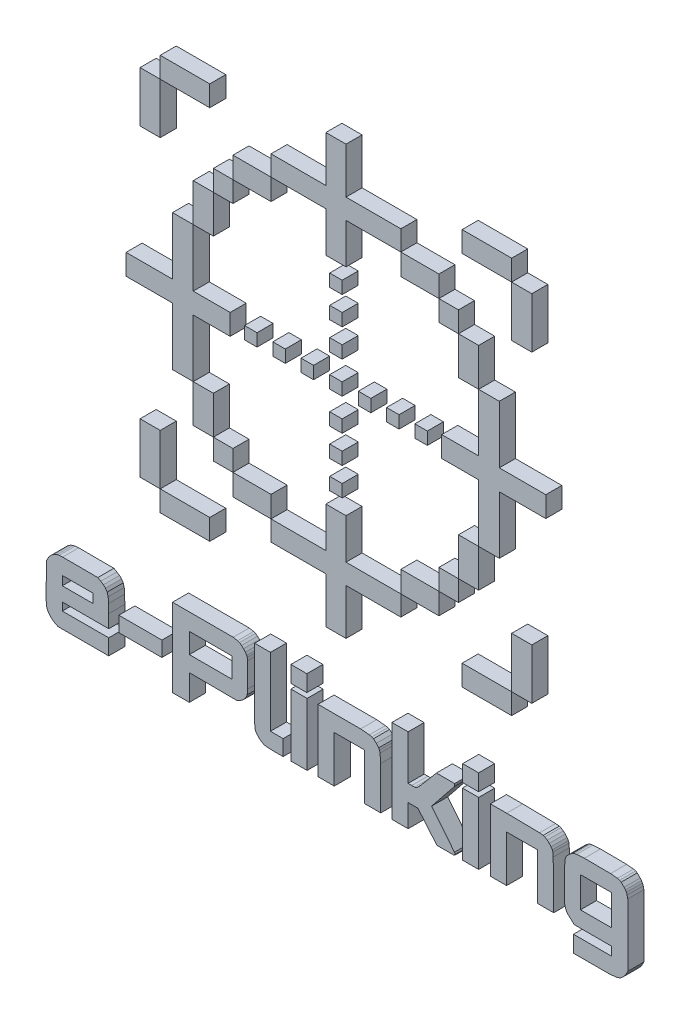
from build123d import *

# Parameters (mm, degrees)
FRAME_190_X_150_W           = 12.335633057
FRAME_190_X_150_H           = 5.156887646
RESSALTO_EXTRUS_O4_DEPTH    = 4
FRAME_190_X_150_W_2         = 5.017869899
FRAME_190_X_150_H_2         = 12.614788256
RESSALTO_EXTRUS_O4_2_DEPTH  = 4
FRAME_190_X_150_W_3         = 5.0178699
RESSALTO_EXTRUS_O4_3_DEPTH  = 4
FRAME_190_X_150_W_4         = 12.335633056
RESSALTO_EXTRUS_O4_4_DEPTH  = 4
FRAME_190_X_150_W_5         = 7.666212514
FRAME_190_X_150_H_3         = 2.230469951
RESSALTO_EXTRUS_O4_5_DEPTH  = 4
FRAME_190_X_150_W_6         = 10.732701735
FRAME_190_X_150_H_4         = 3.762804679
RESSALTO_EXTRUS_O4_6_DEPTH  = 4
FRAME_190_X_150_W_7         = 10.593312509
FRAME_190_X_150_H_5         = 5.0178699
RESSALTO_EXTRUS_O4_7_DEPTH  = 4
RESSALTO_EXTRUS_O4_8_DEPTH  = 4
FRAME_190_X_150_W_8         = 3.979554766
FRAME_190_X_150_H_6         = 4.087064128
RESSALTO_EXTRUS_O4_9_DEPTH  = 4
FRAME_190_X_150_W_9         = 4.042187463
FRAME_190_X_150_H_7         = 15.541508117
RESSALTO_EXTRUS_O4_10_DEPTH = 4
RESSALTO_EXTRUS_O4_11_DEPTH = 4
RESSALTO_EXTRUS_O4_12_DEPTH = 4
FRAME_190_X_150_W_10        = 3.972590477
RESSALTO_EXTRUS_O4_13_DEPTH = 4
FRAME_190_X_150_W_11        = 4.049210035
RESSALTO_EXTRUS_O4_14_DEPTH = 4
RESSALTO_EXTRUS_O4_15_DEPTH = 4
FRAME_190_X_150_W_12        = 7.735909971
FRAME_190_X_150_H_8         = 7.596504733
RESSALTO_EXTRUS_O4_16_DEPTH = 4
RESSALTO_EXTRUS_O4_17_DEPTH = 4
RESSALTO_EXTRUS_O4_18_DEPTH = 4
RESSALTO_EXTRUS_O4_19_DEPTH = 4
RESSALTO_EXTRUS_O4_20_DEPTH = 4
RESSALTO_EXTRUS_O4_21_DEPTH = 4
RESSALTO_EXTRUS_O4_22_DEPTH = 4
FRAME_190_X_150_W_13        = 9.478251135
FRAME_190_X_150_H_9         = 5.296605935
RESSALTO_EXTRUS_O4_23_DEPTH = 4
FRAME_190_X_150_W_14        = 4.878496646
FRAME_190_X_150_H_10        = 5.157269663
RESSALTO_EXTRUS_O4_24_DEPTH = 4
FRAME_190_X_150_H_11        = 9.471940172
RESSALTO_EXTRUS_O4_25_DEPTH = 4
RESSALTO_EXTRUS_O4_26_DEPTH = 4
FRAME_190_X_150_W_15        = 9.478251136
RESSALTO_EXTRUS_O4_27_DEPTH = 4
FRAME_190_X_150_W_16        = 4.878496645
RESSALTO_EXTRUS_O4_28_DEPTH = 4
RESSALTO_EXTRUS_O4_29_DEPTH = 4
RESSALTO_EXTRUS_O4_30_DEPTH = 4
RESSALTO_EXTRUS_O4_31_DEPTH = 4
RESSALTO_EXTRUS_O4_32_DEPTH = 4
FRAME_190_X_150_H_12        = 9.471940171
RESSALTO_EXTRUS_O4_33_DEPTH = 4
RESSALTO_EXTRUS_O4_34_DEPTH = 4
RESSALTO_EXTRUS_O4_35_DEPTH = 4
RESSALTO_EXTRUS_O4_36_DEPTH = 4
FRAME_190_X_150_W_17        = 3.111095359
FRAME_190_X_150_H_13        = 3.111095359
RESSALTO_EXTRUS_O4_37_DEPTH = 4
RESSALTO_EXTRUS_O4_38_DEPTH = 4
RESSALTO_EXTRUS_O4_39_DEPTH = 4
RESSALTO_EXTRUS_O4_40_DEPTH = 4
FRAME_190_X_150_W_18        = 3.111095358
RESSALTO_EXTRUS_O4_41_DEPTH = 4
RESSALTO_EXTRUS_O4_42_DEPTH = 4
RESSALTO_EXTRUS_O4_43_DEPTH = 4
RESSALTO_EXTRUS_O4_44_DEPTH = 4
RESSALTO_EXTRUS_O4_45_DEPTH = 4
RESSALTO_EXTRUS_O4_46_DEPTH = 4
FRAME_190_X_150_H_14        = 3.111095358
RESSALTO_EXTRUS_O4_47_DEPTH = 4
RESSALTO_EXTRUS_O4_48_DEPTH = 4
RESSALTO_EXTRUS_O4_49_DEPTH = 4


with BuildPart() as part:
    # Frame 190 x 150 → Ressalto-extrusão4 (new body)
    with BuildSketch(Plane.XY):
        with Locations((-37.518982292, -26.483801688)):
            Rectangle(FRAME_190_X_150_W, FRAME_190_X_150_H)
    extrude(amount=RESSALTO_EXTRUS_O4_DEPTH)


with BuildPart() as body_2:
    # Frame 190 x 150 → Ressalto-extrus_o4 2 (new body)
    with BuildSketch(Plane.XY):
        with Locations((-46.19573377, -17.597963737)):
            Rectangle(FRAME_190_X_150_W_2, FRAME_190_X_150_H_2)
    extrude(amount=RESSALTO_EXTRUS_O4_2_DEPTH)


with BuildPart() as body_3:
    # Frame 190 x 150 → Ressalto-extrus_o4 3 (new body)
    with BuildSketch(Plane.XY):
        with Locations((46.355888486, -17.597963737)):
            Rectangle(FRAME_190_X_150_W_3, FRAME_190_X_150_H_2)
    extrude(amount=RESSALTO_EXTRUS_O4_3_DEPTH)


with BuildPart() as body_4:
    # Frame 190 x 150 → Ressalto-extrus_o4 4 (new body)
    with BuildSketch(Plane.XY):
        with Locations((37.679137008, -26.483801688)):
            Rectangle(FRAME_190_X_150_W_4, FRAME_190_X_150_H)
    extrude(amount=RESSALTO_EXTRUS_O4_4_DEPTH)


with BuildPart() as body_5:
    # Frame 190 x 150 → Ressalto-extrus_o4 5 (new body)
    with BuildSketch(Plane.XY):
        Polygon((-68.869344875, -50.835307482), (-67.983813166, -50.770338374), (-59.228510836, -50.806122616), (-58.482023291, -51.21959113), (-57.835129582, -51.656288372), (-57.328088695, -52.125597393), (-56.899627634, -52.782485781), (-56.651991155, -53.657518124), (-56.538004284, -55.045981586), (-56.510492046, -57.243468657), (-56.510492046, -60.493736295), (-68.079508065, -60.493736295), (-68.079508065, -62.462169884), (-56.510492046, -62.445101171), (-56.510492046, -66.347630733), (-69.124898287, -66.344436369), (-69.827144147, -66.017891859), (-70.508264841, -65.593038935), (-71.120546464, -65.009283662), (-71.610311074, -64.328233035), (-71.923882835, -63.611492992), (-72.031223444, -63.054457104), (-72.090266969, -62.139327509), (-72.051998281, -53.593828116), (-71.674263435, -52.877684951), (-71.249875159, -52.231957078), (-70.717564146, -51.683814833), (-70.099616131, -51.252240313), (-69.388617133, -50.949675405), align=None)
        with Locations((-64.246401808, -55.89384969)):
            Rectangle(FRAME_190_X_150_W_5, FRAME_190_X_150_H_3, mode=Mode.SUBTRACT)
    extrude(amount=RESSALTO_EXTRUS_O4_5_DEPTH)


with BuildPart() as body_6:
    # Frame 190 x 150 → Ressalto-extrus_o4 6 (new body)
    with BuildSketch(Plane.XY):
        with Locations((-48.635203594, -58.194171546)):
            Rectangle(FRAME_190_X_150_W_6, FRAME_190_X_150_H_4)
    extrude(amount=RESSALTO_EXTRUS_O4_6_DEPTH)


with BuildPart() as body_7:
    # Frame 190 x 150 → Ressalto-extrus_o4 7 (new body)
    with BuildSketch(Plane.XY):
        Polygon((-36.438954496, -66.340281739), (-40.620525917, -66.340281739), (-40.620525917, -46.82527381), (-25.507074981, -46.82527381), (-24.422824579, -47.031835273), (-23.963932214, -47.205453064), (-23.44963607, -47.551278899), (-22.935708694, -48.014130256), (-22.478018515, -48.537310034), (-22.132432907, -49.064120074), (-21.993611584, -49.436708492), (-21.90933165, -50.074356648), (-21.951471617, -56.237777076), (-22.018569962, -57.496724298), (-22.288512194, -58.153539986), (-22.660069641, -58.708447025), (-23.149983339, -59.181418971), (-23.774993271, -59.592430433), (-24.521478583, -60.005902979), (-36.438954496, -59.924421917), align=None)
        with Locations((-31.142298242, -53.524451509)):
            Rectangle(FRAME_190_X_150_W_7, FRAME_190_X_150_H_5, mode=Mode.SUBTRACT)
    extrude(amount=RESSALTO_EXTRUS_O4_7_DEPTH)


with BuildPart() as body_8:
    # Frame 190 x 150 → Ressalto-extrus_o4 8 (new body)
    with BuildSketch(Plane.XY):
        Polygon((-20.159080754, -62.68228913), (-20.159080754, -45.440079454), (-16.228048548, -45.440079454), (-16.228048548, -62.467317111), (-13.061605111, -62.464445985), (-13.061605111, -66.347578419), (-15.758864703, -66.35002412), (-17.100603293, -66.294097935), (-17.598367545, -66.215262605), (-17.971780951, -66.084293417), (-18.544928861, -65.760611078), (-19.081120372, -65.338386419), (-19.54154418, -64.853088649), (-19.887412159, -64.340039469), (-20.064088622, -63.862728698), align=None)
    extrude(amount=RESSALTO_EXTRUS_O4_8_DEPTH)


with BuildPart() as body_9:
    # Frame 190 x 150 → Ressalto-extrus_o4 9 (new body)
    with BuildSketch(Plane.XY):
        with Locations((-9.15074114, -47.553297957)):
            Rectangle(FRAME_190_X_150_W_8, FRAME_190_X_150_H_6)
    extrude(amount=RESSALTO_EXTRUS_O4_9_DEPTH)


with BuildPart() as body_10:
    # Frame 190 x 150 → Ressalto-extrus_o4 10 (new body)
    with BuildSketch(Plane.XY):
        with Locations((-9.119424792, -58.576876674)):
            Rectangle(FRAME_190_X_150_W_9, FRAME_190_X_150_H_7)
    extrude(amount=RESSALTO_EXTRUS_O4_10_DEPTH)


with BuildPart() as body_11:
    # Frame 190 x 150 → Ressalto-extrus_o4 11 (new body)
    with BuildSketch(Plane.XY):
        Polygon((8.402580971, -50.924974899), (6.224273851, -50.725864668), (-0.338051222, -50.725864668), (-4.380238684, -50.725864668), (-4.380238684, -66.347630733), (-0.338051222, -66.347630733), (-0.338051222, -54.778614714), (7.188936992, -54.778614714), (7.188936992, -66.347630733), (11.241379874, -66.347630733), (11.241379874, -55.669331308), (11.054377893, -53.525832247), (10.933207411, -52.943834947), (10.749718213, -52.545836272), (10.138693563, -51.874325685), (9.430858753, -51.243906447), (9.008624085, -51.052623063), align=None)
    extrude(amount=RESSALTO_EXTRUS_O4_11_DEPTH)


with BuildPart() as body_12:
    # Frame 190 x 150 → Ressalto-extrus_o4 12 (new body)
    with BuildSketch(Plane.XY):
        Polygon((18.060884257, -60.702507483), (18.060884257, -66.347630733), (14.018696795, -66.347630733), (14.018696795, -45.440079454), (18.060884257, -45.440079454), (18.060884257, -56.562016339), (18.973591861, -56.562016339), (19.665189081, -56.555233118), (20.144030768, -56.481676969), (21.055733445, -55.580381982), (25.104489113, -50.806122616), (29.652433594, -50.806122616), (29.62989502, -51.160435483), (29.541480137, -51.530099567), (23.915084257, -58.538782036), (29.605751219, -65.644555984), (29.767150657, -66.0340124), (29.73184476, -66.214831714), (29.46390878, -66.344436369), (25.239247662, -66.345526959), (20.496454906, -60.702507483), align=None)
    extrude(amount=RESSALTO_EXTRUS_O4_12_DEPTH)


with BuildPart() as body_13:
    # Frame 190 x 150 → Ressalto-extrus_o4 13 (new body)
    with BuildSketch(Plane.XY):
        with Locations((33.637152285, -47.553297957)):
            Rectangle(FRAME_190_X_150_W_10, FRAME_190_X_150_H_6)
    extrude(amount=RESSALTO_EXTRUS_O4_13_DEPTH)


with BuildPart() as body_14:
    # Frame 190 x 150 → Ressalto-extrus_o4 14 (new body)
    with BuildSketch(Plane.XY):
        with Locations((33.603604721, -58.576876674)):
            Rectangle(FRAME_190_X_150_W_11, FRAME_190_X_150_H_7)
    extrude(amount=RESSALTO_EXTRUS_O4_14_DEPTH)


with BuildPart() as body_15:
    # Frame 190 x 150 → Ressalto-extrus_o4 15 (new body)
    with BuildSketch(Plane.XY):
        Polygon((50.258994574, -54.778614714), (42.592782059, -54.778614714), (42.592782059, -66.347630733), (38.550594597, -66.347630733), (38.550594597, -50.725864668), (42.592782059, -50.725864668), (50.817670103, -50.841173835), (51.720713048, -50.938579294), (52.102574523, -51.092260265), (52.705685291, -51.469391), (53.214175966, -51.918144337), (53.651566917, -52.422788681), (53.976320266, -52.941461581), (54.11612462, -53.395248082), (54.198164022, -54.3783886), (54.314146883, -66.347630733), (50.258994574, -66.347630733), align=None)
    extrude(amount=RESSALTO_EXTRUS_O4_15_DEPTH)


with BuildPart() as body_16:
    # Frame 190 x 150 → Ressalto-extrus_o4 16 (new body)
    with BuildSketch(Plane.XY):
        Polygon((57.71413348, -64.784806147), (59.461291158, -66.344436369), (68.727532317, -66.344436369), (68.727532317, -68.508071463), (59.249338867, -68.508071463), (59.249338867, -72.606807024), (68.07435158, -72.606807024), (69.918129299, -72.436417547), (70.854125399, -72.146436969), (71.556102591, -71.584053945), (72.047322787, -71.033770213), (72.442653691, -70.420573521), (72.769703946, -69.762579883), (72.769703946, -54.124276686), (72.610489227, -53.391351857), (72.433204823, -52.870173439), (72.183350465, -52.471639522), (71.849447443, -52.07746445), (71.123639909, -51.337842321), (70.731222282, -51.110856878), (70.212229081, -50.957765268), (68.473816953, -50.809298542), (61.953515158, -50.759516374), (60.054566511, -50.869741807), (59.459061747, -50.992915228), (59.00541169, -51.174719154), (58.241304913, -51.753985987), (57.546432842, -52.484193982), (57.328809378, -52.886180099), (57.178902874, -53.406834339), (57.02576069, -55.086382585), (56.974053024, -58.087316355), (56.979984929, -61.650251217), (57.088186876, -63.347741104), (57.327858482, -64.09273461), align=None)
        with Locations((64.859619683, -58.576867081)):
            Rectangle(FRAME_190_X_150_W_12, FRAME_190_X_150_H_8, mode=Mode.SUBTRACT)
    extrude(amount=RESSALTO_EXTRUS_O4_16_DEPTH)


with BuildPart() as body_17:
    # Frame 190 x 150 → Ressalto-extrus_o4 17 (new body)
    with BuildSketch(Plane.XY):
        Polygon((2.589012308, -21.605045444), (2.589012308, -33.034682246), (-2.428857592, -33.034682246), (-2.428857592, -21.605045444), (-16.088675126, -21.605045444), (-16.088675126, -16.587175544), (-2.428857592, -16.587175544), (-2.428857592, -6.55148343), (2.589012308, -6.55148343), (2.589012308, -16.587175544), (16.248829842, -16.587175544), (16.248829842, -21.605045444), align=None)
    extrude(amount=RESSALTO_EXTRUS_O4_17_DEPTH)


with BuildPart() as body_18:
    # Frame 190 x 150 → Ressalto-extrus_o4 18 (new body)
    with BuildSketch(Plane.XY):
        Polygon((-2.428857592, 62.165634166), (-2.428857592, 73.595270968), (2.589012308, 73.595270968), (2.589012308, 62.165634166), (16.248829842, 62.165634166), (16.248829842, 57.147764266), (2.589012308, 57.147764266), (2.589012308, 47.112072151), (-2.428857592, 47.112072151), (-2.428857592, 57.147764266), (-16.088675126, 57.147764266), (-16.088675126, 62.165634166), align=None)
    extrude(amount=RESSALTO_EXTRUS_O4_18_DEPTH)


with BuildPart() as body_19:
    # Frame 190 x 150 → Ressalto-extrus_o4 19 (new body)
    with BuildSketch(Plane.XY):
        with Locations((37.679137008, 67.04439041)):
            Rectangle(FRAME_190_X_150_W_4, FRAME_190_X_150_H)
    extrude(amount=RESSALTO_EXTRUS_O4_19_DEPTH)


with BuildPart() as body_20:
    # Frame 190 x 150 → Ressalto-extrus_o4 20 (new body)
    with BuildSketch(Plane.XY):
        with Locations((46.355888486, 58.158552459)):
            Rectangle(FRAME_190_X_150_W_3, FRAME_190_X_150_H_2)
    extrude(amount=RESSALTO_EXTRUS_O4_20_DEPTH)


with BuildPart() as body_21:
    # Frame 190 x 150 → Ressalto-extrus_o4 21 (new body)
    with BuildSketch(Plane.XY):
        with Locations((-37.518982292, 67.04439041)):
            Rectangle(FRAME_190_X_150_W, FRAME_190_X_150_H)
    extrude(amount=RESSALTO_EXTRUS_O4_21_DEPTH)


with BuildPart() as body_22:
    # Frame 190 x 150 → Ressalto-extrus_o4 22 (new body)
    with BuildSketch(Plane.XY):
        with Locations((-46.19573377, 58.158552459)):
            Rectangle(FRAME_190_X_150_W_2, FRAME_190_X_150_H_2)
    extrude(amount=RESSALTO_EXTRUS_O4_22_DEPTH)


with BuildPart() as body_23:
    # Frame 190 x 150 → Ressalto-extrus_o4 23 (new body)
    with BuildSketch(Plane.XY):
        with Locations((20.987955409, 54.499461299)):
            Rectangle(FRAME_190_X_150_W_13, FRAME_190_X_150_H_9)
    extrude(amount=RESSALTO_EXTRUS_O4_23_DEPTH)


with BuildPart() as body_24:
    # Frame 190 x 150 → Ressalto-extrus_o4 24 (new body)
    with BuildSketch(Plane.XY):
        with Locations((28.1663293, 49.272523499)):
            Rectangle(FRAME_190_X_150_W_14, FRAME_190_X_150_H_10)
    extrude(amount=RESSALTO_EXTRUS_O4_24_DEPTH)


with BuildPart() as body_25:
    # Frame 190 x 150 → Ressalto-extrus_o4 25 (new body)
    with BuildSketch(Plane.XY):
        with Locations((33.114512573, 41.957918582)):
            Rectangle(FRAME_190_X_150_W_3, FRAME_190_X_150_H_11)
    extrude(amount=RESSALTO_EXTRUS_O4_25_DEPTH)


with BuildPart() as body_26:
    # Frame 190 x 150 → Ressalto-extrus_o4 26 (new body)
    with BuildSketch(Plane.XY):
        Polygon((35.623447523, 3.338640225), (35.623447523, 17.70165953), (26.424237809, 17.70165953), (26.424237809, 22.858929192), (35.623447523, 22.858929192), (35.623447523, 37.221948496), (40.780717073, 37.221948496), (40.780717073, 22.858929192), (52.349733092, 22.858929192), (52.349733092, 17.70165953), (40.780717073, 17.70165953), (40.780717073, 3.338640225), align=None)
    extrude(amount=RESSALTO_EXTRUS_O4_26_DEPTH)


with BuildPart() as body_27:
    # Frame 190 x 150 → Ressalto-extrus_o4 27 (new body)
    with BuildSketch(Plane.XY):
        with Locations((-20.827800694, 54.499461299)):
            Rectangle(FRAME_190_X_150_W_15, FRAME_190_X_150_H_9)
    extrude(amount=RESSALTO_EXTRUS_O4_27_DEPTH)


with BuildPart() as body_28:
    # Frame 190 x 150 → Ressalto-extrus_o4 28 (new body)
    with BuildSketch(Plane.XY):
        with Locations((-28.006174585, 49.272523499)):
            Rectangle(FRAME_190_X_150_W_16, FRAME_190_X_150_H_10)
    extrude(amount=RESSALTO_EXTRUS_O4_28_DEPTH)


with BuildPart() as body_29:
    # Frame 190 x 150 → Ressalto-extrus_o4 29 (new body)
    with BuildSketch(Plane.XY):
        with Locations((-32.954357857, 41.957918582)):
            Rectangle(FRAME_190_X_150_W_3, FRAME_190_X_150_H_11)
    extrude(amount=RESSALTO_EXTRUS_O4_29_DEPTH)


with BuildPart() as body_30:
    # Frame 190 x 150 → Ressalto-extrus_o4 30 (new body)
    with BuildSketch(Plane.XY):
        Polygon((-40.620562358, 17.70165953), (-52.189578377, 17.70165953), (-52.189578377, 22.858929192), (-40.620562358, 22.858929192), (-40.620562358, 37.221948496), (-35.463292807, 37.221948496), (-35.463292807, 22.858929192), (-26.264083094, 22.858929192), (-26.264083094, 17.70165953), (-35.463292807, 17.70165953), (-35.463292807, 3.338640225), (-40.620562358, 3.338640225), align=None)
    extrude(amount=RESSALTO_EXTRUS_O4_30_DEPTH)


with BuildPart() as body_31:
    # Frame 190 x 150 → Ressalto-extrus_o4 31 (new body)
    with BuildSketch(Plane.XY):
        with Locations((20.987955409, -13.938872576)):
            Rectangle(FRAME_190_X_150_W_13, FRAME_190_X_150_H_9)
    extrude(amount=RESSALTO_EXTRUS_O4_31_DEPTH)


with BuildPart() as body_32:
    # Frame 190 x 150 → Ressalto-extrus_o4 32 (new body)
    with BuildSketch(Plane.XY):
        with Locations((28.1663293, -8.711934777)):
            Rectangle(FRAME_190_X_150_W_14, FRAME_190_X_150_H_10)
    extrude(amount=RESSALTO_EXTRUS_O4_32_DEPTH)


with BuildPart() as body_33:
    # Frame 190 x 150 → Ressalto-extrus_o4 33 (new body)
    with BuildSketch(Plane.XY):
        with Locations((33.114512573, -1.39732986)):
            Rectangle(FRAME_190_X_150_W_3, FRAME_190_X_150_H_12)
    extrude(amount=RESSALTO_EXTRUS_O4_33_DEPTH)


with BuildPart() as body_34:
    # Frame 190 x 150 → Ressalto-extrus_o4 34 (new body)
    with BuildSketch(Plane.XY):
        with Locations((-32.954357857, -1.39732986)):
            Rectangle(FRAME_190_X_150_W_3, FRAME_190_X_150_H_12)
    extrude(amount=RESSALTO_EXTRUS_O4_34_DEPTH)


with BuildPart() as body_35:
    # Frame 190 x 150 → Ressalto-extrus_o4 35 (new body)
    with BuildSketch(Plane.XY):
        with Locations((-28.006174585, -8.711934777)):
            Rectangle(FRAME_190_X_150_W_16, FRAME_190_X_150_H_10)
    extrude(amount=RESSALTO_EXTRUS_O4_35_DEPTH)


with BuildPart() as body_36:
    # Frame 190 x 150 → Ressalto-extrus_o4 36 (new body)
    with BuildSketch(Plane.XY):
        with Locations((-20.827800694, -13.938872576)):
            Rectangle(FRAME_190_X_150_W_15, FRAME_190_X_150_H_9)
    extrude(amount=RESSALTO_EXTRUS_O4_36_DEPTH)


with BuildPart() as body_37:
    # Frame 190 x 150 → Ressalto-extrus_o4 37 (new body)
    with BuildSketch(Plane.XY):
        with Locations((0.080077358, -1.650636469)):
            Rectangle(FRAME_190_X_150_W_17, FRAME_190_X_150_H_13)
    extrude(amount=RESSALTO_EXTRUS_O4_37_DEPTH)


with BuildPart() as body_38:
    # Frame 190 x 150 → Ressalto-extrus_o4 38 (new body)
    with BuildSketch(Plane.XY):
        with Locations((0.080077358, 5.318647828)):
            Rectangle(FRAME_190_X_150_W_17, FRAME_190_X_150_H_13)
    extrude(amount=RESSALTO_EXTRUS_O4_38_DEPTH)


with BuildPart() as body_39:
    # Frame 190 x 150 → Ressalto-extrus_o4 39 (new body)
    with BuildSketch(Plane.XY):
        with Locations((0.080077358, 12.287935285)):
            Rectangle(FRAME_190_X_150_W_17, FRAME_190_X_150_H_13)
    extrude(amount=RESSALTO_EXTRUS_O4_39_DEPTH)


with BuildPart() as body_40:
    # Frame 190 x 150 → Ressalto-extrus_o4 40 (new body)
    with BuildSketch(Plane.XY):
        with Locations((0.080077358, 20.280294361)):
            Rectangle(FRAME_190_X_150_W_17, FRAME_190_X_150_H_13)
    extrude(amount=RESSALTO_EXTRUS_O4_40_DEPTH)


with BuildPart() as body_41:
    # Frame 190 x 150 → Ressalto-extrus_o4 41 (new body)
    with BuildSketch(Plane.XY):
        with Locations((7.211085839, 20.280294361)):
            Rectangle(FRAME_190_X_150_W_18, FRAME_190_X_150_H_13)
    extrude(amount=RESSALTO_EXTRUS_O4_41_DEPTH)


with BuildPart() as body_42:
    # Frame 190 x 150 → Ressalto-extrus_o4 42 (new body)
    with BuildSketch(Plane.XY):
        with Locations((14.250070007, 20.280294361)):
            Rectangle(FRAME_190_X_150_W_17, FRAME_190_X_150_H_13)
    extrude(amount=RESSALTO_EXTRUS_O4_42_DEPTH)


with BuildPart() as body_43:
    # Frame 190 x 150 → Ressalto-extrus_o4 43 (new body)
    with BuildSketch(Plane.XY):
        with Locations((21.289044711, 20.280294361)):
            Rectangle(FRAME_190_X_150_W_17, FRAME_190_X_150_H_13)
    extrude(amount=RESSALTO_EXTRUS_O4_43_DEPTH)


with BuildPart() as body_44:
    # Frame 190 x 150 → Ressalto-extrus_o4 44 (new body)
    with BuildSketch(Plane.XY):
        with Locations((-7.050931123, 20.280294361)):
            Rectangle(FRAME_190_X_150_W_17, FRAME_190_X_150_H_13)
    extrude(amount=RESSALTO_EXTRUS_O4_44_DEPTH)


with BuildPart() as body_45:
    # Frame 190 x 150 → Ressalto-extrus_o4 45 (new body)
    with BuildSketch(Plane.XY):
        with Locations((-14.089915292, 20.280294361)):
            Rectangle(FRAME_190_X_150_W_17, FRAME_190_X_150_H_13)
    extrude(amount=RESSALTO_EXTRUS_O4_45_DEPTH)


with BuildPart() as body_46:
    # Frame 190 x 150 → Ressalto-extrus_o4 46 (new body)
    with BuildSketch(Plane.XY):
        with Locations((-21.128889994, 20.280294361)):
            Rectangle(FRAME_190_X_150_W_17, FRAME_190_X_150_H_13)
    extrude(amount=RESSALTO_EXTRUS_O4_46_DEPTH)


with BuildPart() as body_47:
    # Frame 190 x 150 → Ressalto-extrus_o4 47 (new body)
    with BuildSketch(Plane.XY):
        with Locations((0.080077358, 42.21122519)):
            Rectangle(FRAME_190_X_150_W_17, FRAME_190_X_150_H_14)
    extrude(amount=RESSALTO_EXTRUS_O4_47_DEPTH)


with BuildPart() as body_48:
    # Frame 190 x 150 → Ressalto-extrus_o4 48 (new body)
    with BuildSketch(Plane.XY):
        with Locations((0.080077358, 35.241940895)):
            Rectangle(FRAME_190_X_150_W_17, FRAME_190_X_150_H_13)
    extrude(amount=RESSALTO_EXTRUS_O4_48_DEPTH)


with BuildPart() as body_49:
    # Frame 190 x 150 → Ressalto-extrus_o4 49 (new body)
    with BuildSketch(Plane.XY):
        with Locations((0.080077358, 28.272653438)):
            Rectangle(FRAME_190_X_150_W_17, FRAME_190_X_150_H_13)
    extrude(amount=RESSALTO_EXTRUS_O4_49_DEPTH)


solid = Compound([part.part, body_2.part, body_3.part, body_4.part, body_5.part, body_6.part, body_7.part, body_8.part, body_9.part, body_10.part, body_11.part, body_12.part, body_13.part, body_14.part, body_15.part, body_16.part, body_17.part, body_18.part, body_19.part, body_20.part, body_21.part, body_22.part, body_23.part, body_24.part, body_25.part, body_26.part, body_27.part, body_28.part, body_29.part, body_30.part, body_31.part, body_32.part, body_33.part, body_34.part, body_35.part, body_36.part, body_37.part, body_38.part, body_39.part, body_40.part, body_41.part, body_42.part, body_43.part, body_44.part, body_45.part, body_46.part, body_47.part, body_48.part, body_49.part])
